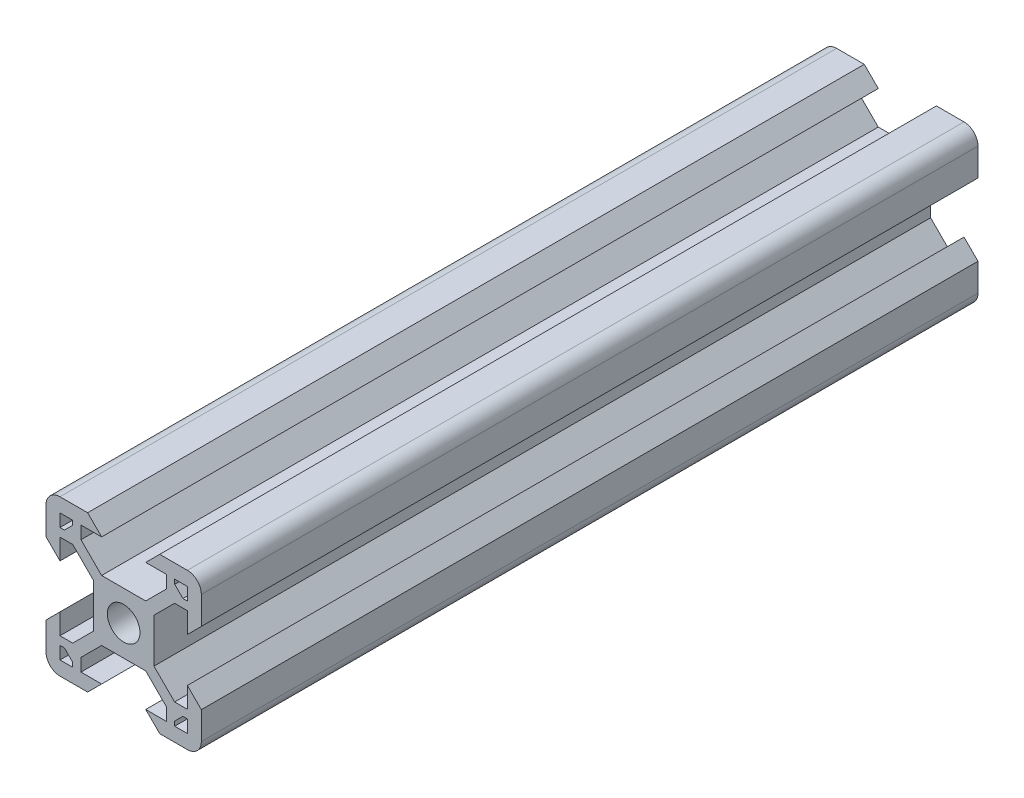
from build123d import *

# Parameters (mm, degrees)
ESQUISSE1_R        = 2.1
BOSS_EXTRU_2_DEPTH = 50


with BuildPart() as part:
    # Esquisse1 → Boss.-Extru.2 (new, symmetric)
    with BuildSketch(Plane.XY):
        with BuildLine():
            Line((-3.900660172, 0), (-3.900660172, -2.84))
            Line((-3.900660172, -2.84), (-6.56, -5.499339828))
            Line((-6.56, -5.499339828), (-8.2, -5.499339828))
            Line((-8.2, -5.499339828), (-8.2, -2.84))
            Line((-8.2, -2.84), (-10, -4.64))
            Line((-10, -4.64), (-10, -8.2))
            ThreePointArc((-10, -8.2), (-9.472792206, -9.472792206), (-8.2, -10))
            Line((-8.2, -10), (-4.64, -10))
            Line((-4.64, -10), (-2.84, -8.2))
            Line((-2.84, -8.2), (-5.499339828, -8.2))
            Line((-5.499339828, -8.2), (-5.499339828, -6.56))
            Line((-5.499339828, -6.56), (-2.84, -3.900660172))
            Line((-2.84, -3.900660172), (0, -3.900660172))
            Line((0, -3.900660172), (2.84, -3.900660172))
            Line((2.84, -3.900660172), (5.499339828, -6.56))
            Line((5.499339828, -6.56), (5.499339828, -8.2))
            Line((5.499339828, -8.2), (2.84, -8.2))
            Line((2.84, -8.2), (4.64, -10))
            Line((4.64, -10), (8.2, -10))
            ThreePointArc((8.2, -10), (9.472792206, -9.472792206), (10, -8.2))
            Line((10, -8.2), (10, -4.64))
            Line((10, -4.64), (8.2, -2.84))
            Line((8.2, -2.84), (8.2, -5.499339828))
            Line((8.2, -5.499339828), (6.56, -5.499339828))
            Line((6.56, -5.499339828), (3.900660172, -2.84))
            Line((3.900660172, -2.84), (3.900660172, 0))
            Line((3.900660172, 0), (3.900660172, 2.84))
            Line((3.900660172, 2.84), (6.56, 5.499339828))
            Line((6.56, 5.499339828), (8.2, 5.499339828))
            Line((8.2, 5.499339828), (8.2, 2.84))
            Line((8.2, 2.84), (10, 4.64))
            Line((10, 4.64), (10, 8.2))
            ThreePointArc((10, 8.2), (9.472792206, 9.472792206), (8.2, 10))
            Line((8.2, 10), (4.64, 10))
            Line((4.64, 10), (2.84, 8.2))
            Line((2.84, 8.2), (5.499339828, 8.2))
            Line((5.499339828, 8.2), (5.499339828, 6.56))
            Line((5.499339828, 6.56), (2.84, 3.900660172))
            Line((2.84, 3.900660172), (0, 3.900660172))
            Line((0, 3.900660172), (-2.84, 3.900660172))
            Line((-2.84, 3.900660172), (-5.499339828, 6.56))
            Line((-5.499339828, 6.56), (-5.499339828, 8.2))
            Line((-5.499339828, 8.2), (-2.84, 8.2))
            Line((-2.84, 8.2), (-4.64, 10))
            Line((-4.64, 10), (-8.2, 10))
            ThreePointArc((-8.2, 10), (-9.472792206, 9.472792206), (-10, 8.2))
            Line((-10, 8.2), (-10, 4.64))
            Line((-10, 4.64), (-8.2, 2.84))
            Line((-8.2, 2.84), (-8.2, 5.499339828))
            Line((-8.2, 5.499339828), (-6.56, 5.499339828))
            Line((-6.56, 5.499339828), (-3.900660172, 2.84))
            Line((-3.900660172, 2.84), (-3.900660172, 0))
        make_face()
        Circle(ESQUISSE1_R, mode=Mode.SUBTRACT)
        Polygon((-8.2, -8.2), (-8.2, -6.569339828), (-7.63, -6.569339828), (-6.569339828, -7.63), (-6.569339828, -8.2), align=None, mode=Mode.SUBTRACT)
        Polygon((-8.2, 6.569339828), (-8.2, 8.2), (-6.569339828, 8.2), (-6.569339828, 7.63), (-7.63, 6.569339828), align=None, mode=Mode.SUBTRACT)
        Polygon((6.569339828, 8.2), (8.2, 8.2), (8.2, 6.569339828), (7.63, 6.569339828), (6.569339828, 7.63), align=None, mode=Mode.SUBTRACT)
        Polygon((8.2, -6.569339828), (8.2, -8.2), (6.569339828, -8.2), (6.569339828, -7.63), (7.63, -6.569339828), align=None, mode=Mode.SUBTRACT)
    extrude(amount=BOSS_EXTRU_2_DEPTH, both=True)


solid = part.part
